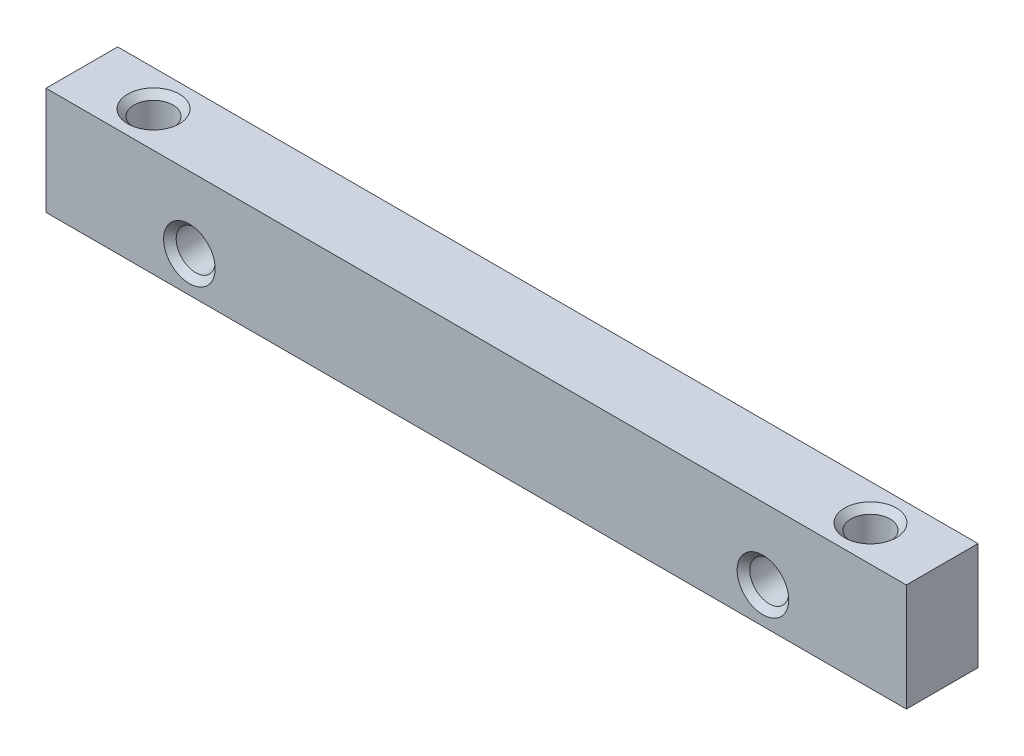
from build123d import *

# Parameters (mm, degrees)
SKETCH1_W                      = 6.35
SKETCH1_H                      = 9.525
BOSS_EXTRUDE1_DEPTH            = 38.1
F_8_32_TAPPED_HOLE1_AT_2_COUNT = 2
F_8_32_TAPPED_HOLE1_AT_2_PITCH = 63.5
F_8_32_TAPPED_HOLE2_AT_2_COUNT = 2
F_8_32_TAPPED_HOLE2_AT_2_PITCH = 50.8


with BuildPart() as part:
    # Sketch1 → Boss-Extrude1 (new, symmetric)
    with BuildSketch(Plane(origin=(0, 0, 0), x_dir=(0, 0, -1), z_dir=(1, 0, 0))):
        Rectangle(SKETCH1_W, SKETCH1_H)
    extrude(amount=BOSS_EXTRUDE1_DEPTH, both=True)

    # Sketch2 → #8-32 Tapped Hole1 (revolve, cut)
    with BuildSketch(Plane(origin=(31.75, 4.7625, 0), x_dir=(0, 0, 1), z_dir=(1, 0, 0))):
        Polygon((0, 0), (0, 9.525), (2.286, 9.525), (1.7272, 8.9662), (1.7272, 0.5588), (2.286, 0), align=None)
    f_8_32_tapped_hole1 = revolve(axis=Axis((31.75, 11.1125, 0), (0, -1, 0)), mode=Mode.SUBTRACT)

    # #8-32 Tapped Hole1 at 2: #8-32 Tapped Hole1 ×2
    with Locations(*[(-i * F_8_32_TAPPED_HOLE1_AT_2_PITCH, 0, 0) for i in range(1, F_8_32_TAPPED_HOLE1_AT_2_COUNT)]):
        add(f_8_32_tapped_hole1, mode=Mode.SUBTRACT)

    # Sketch4 → #8-32 Tapped Hole2 (revolve, cut)
    with BuildSketch(Plane(origin=(25.4, -1.5875, 3.175), x_dir=(0, -1, 0), z_dir=(1, 0, 0))):
        Polygon((0, 0), (0, 6.35), (2.286, 6.35), (1.7272, 5.7912), (1.7272, 0.5588), (2.286, 0), align=None)
    f_8_32_tapped_hole2 = revolve(axis=Axis((25.4, -1.5875, 9.525), (0, 0, -1)), mode=Mode.SUBTRACT)

    # #8-32 Tapped Hole2 at 2: #8-32 Tapped Hole2 ×2
    with Locations(*[(-i * F_8_32_TAPPED_HOLE2_AT_2_PITCH, 0, 0) for i in range(1, F_8_32_TAPPED_HOLE2_AT_2_COUNT)]):
        add(f_8_32_tapped_hole2, mode=Mode.SUBTRACT)


solid = part.part
